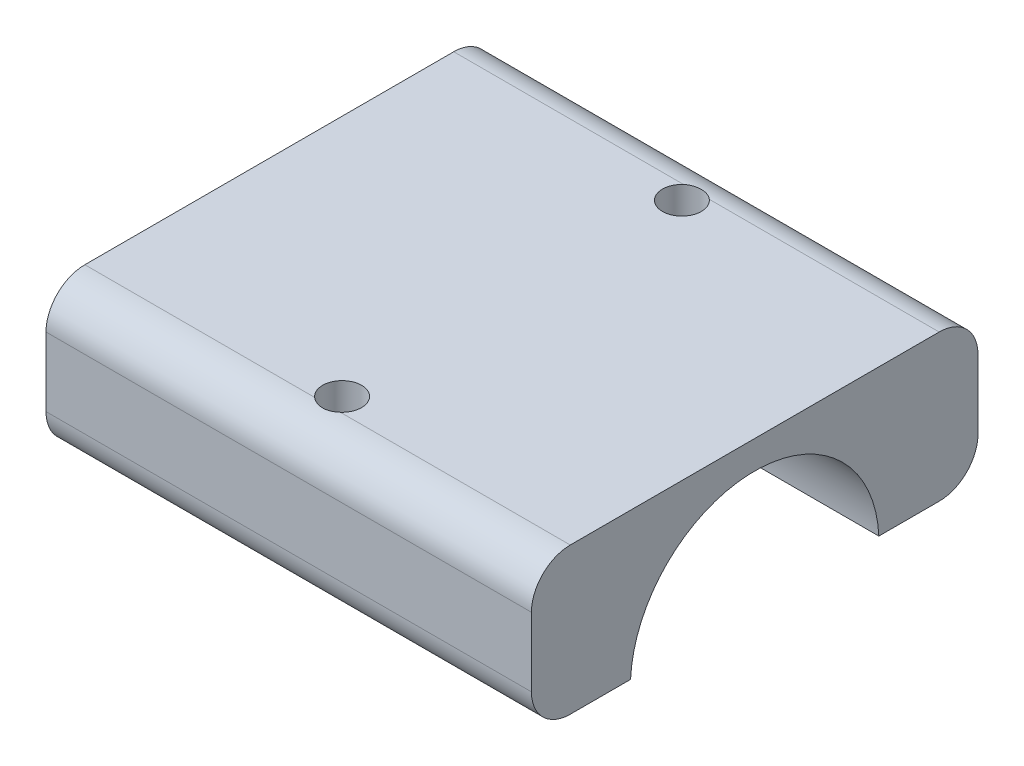
from build123d import *

# Parameters (mm, degrees)
BOSS_EXTRUDE1_DEPTH     = 25
CUT_EXTRUDE1_DEPTH      = 38.423121195
CUT_EXTRUDE1_DEPTH_BACK = 38.423121195
SKETCH2_R               = 12.8
SKETCH3_R               = 2
CUT_EXTRUDE2_DEPTH      = 7.5
SKETCH4_R               = 2
CUT_EXTRUDE3_DEPTH      = 7.5


with BuildPart() as part:
    # Sketch1 → Boss-Extrude1 (new, symmetric)
    with BuildSketch(Plane(origin=(0, 0, 0), x_dir=(0, 0, -1), z_dir=(1, 0, 0))):
        with BuildLine():
            Line((-19, 0.6), (19, 0.6))
            ThreePointArc((19, 0.6), (21.828427125, 1.771572875), (23, 4.6))
            Line((23, 4.6), (23, 11.7))
            ThreePointArc((23, 11.7), (21.828427125, 14.528427125), (19, 15.7))
            Line((19, 15.7), (-19, 15.7))
            ThreePointArc((-19, 15.7), (-21.828427125, 14.528427125), (-23, 11.7))
            Line((-23, 11.7), (-23, 4.6))
            ThreePointArc((-23, 4.6), (-21.828427125, 1.771572875), (-19, 0.6))
        make_face()
    extrude(amount=BOSS_EXTRUDE1_DEPTH, both=True)

    # Sketch2 → Cut-Extrude1 (cut, two sides: drawn at the far end of the back side and taken through both)
    with BuildSketch(Plane(origin=(0, 0, 0), x_dir=(0, 0, -1), z_dir=(1, 0, 0)).offset(-CUT_EXTRUDE1_DEPTH_BACK)):
        Circle(SKETCH2_R)
    extrude(amount=CUT_EXTRUDE1_DEPTH + CUT_EXTRUDE1_DEPTH_BACK, mode=Mode.SUBTRACT)

    # Sketch3 → Cut-Extrude2 (cut)
    with BuildSketch(Plane(origin=(0, 0.6, 0), x_dir=(1, 0, 0), z_dir=(0, 1, 0))):
        with Locations(Location((18, -17.5, 0), (0, 0, 228.590377891))):
            Circle(SKETCH3_R)
        with Locations(Location((18, 17.5, 0), (0, 0, 48.590377891))):
            Circle(SKETCH3_R)
        with Locations(Location((-18, -17.5, 0), (0, 0, 228.590377891))):
            Circle(SKETCH3_R)
        with Locations(Location((-18, 17.5, 0), (0, 0, 48.590377891))):
            Circle(SKETCH3_R)
    extrude(amount=CUT_EXTRUDE2_DEPTH, mode=Mode.SUBTRACT)

    # Sketch4 → Cut-Extrude3 (cut)
    with BuildSketch(Plane(origin=(0, 15.7, 0), x_dir=(1, 0, 0), z_dir=(0, 1, 0))):
        with Locations(Location((0, -17.5, 0), (0, 0, 270))):
            Circle(SKETCH4_R)
        with Locations(Location((0, 17.5, 0), (0, 0, 270))):
            Circle(SKETCH4_R)
    extrude(amount=-CUT_EXTRUDE3_DEPTH, mode=Mode.SUBTRACT)


solid = part.part
